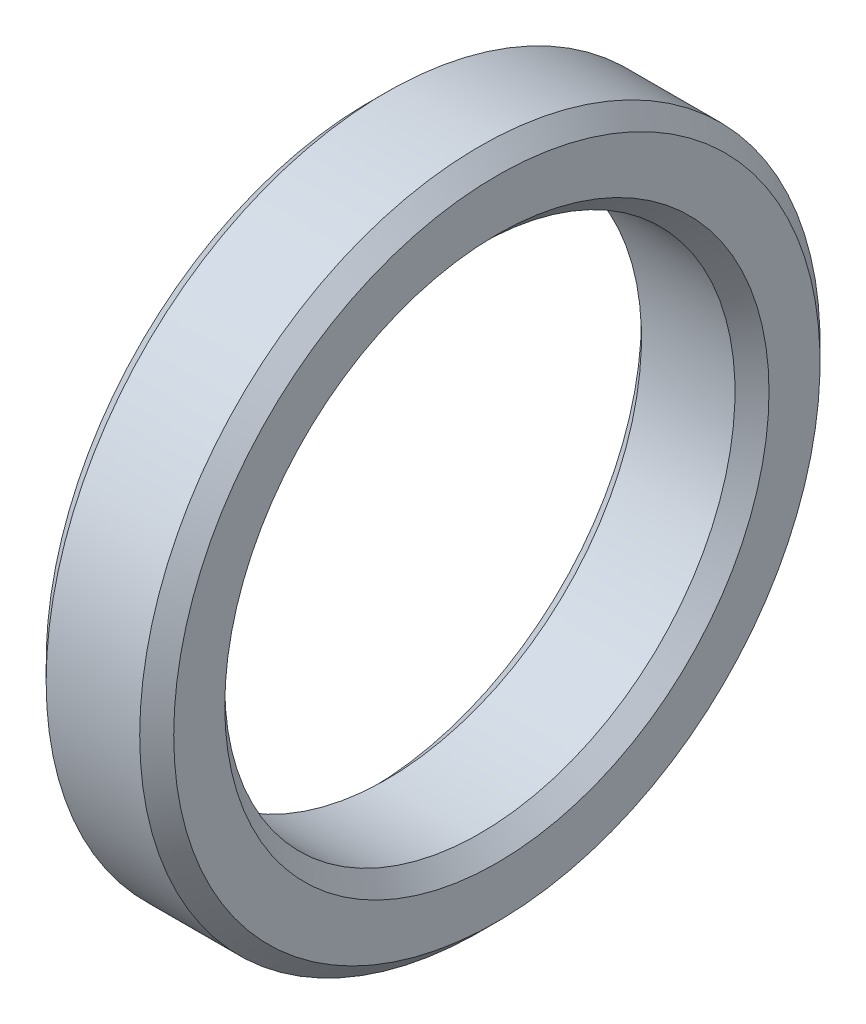
from build123d import *

# Parameters (mm, degrees)
SKETCH1_W     = 1.5
SKETCH1_H     = 1
CHAMFER1_SIZE = 0.2


with BuildPart() as part:
    # Sketch1 → Revolve1 (revolve)
    with BuildSketch(Plane.XY, mode=Mode.PRIVATE) as revolve1_sk:
        with Locations((0.75, 3.5)):
            Rectangle(SKETCH1_W, SKETCH1_H)
    revolve(revolve1_sk.sketch.rotate(Axis((0, 0, 0), (1, 0, 0)), 90), axis=Axis((0, 0, 0), (1, 0, 0)))

    # Chamfer1
    chamfer1_edges = [part.edges().sort_by_distance(p)[0] for p in [
        (0, 0, -3),
        (1.5, 0, -3),
        (1.5, 0, -4),
        (0, 0, -4),
    ]]
    chamfer(chamfer1_edges, length=CHAMFER1_SIZE)


solid = part.part
